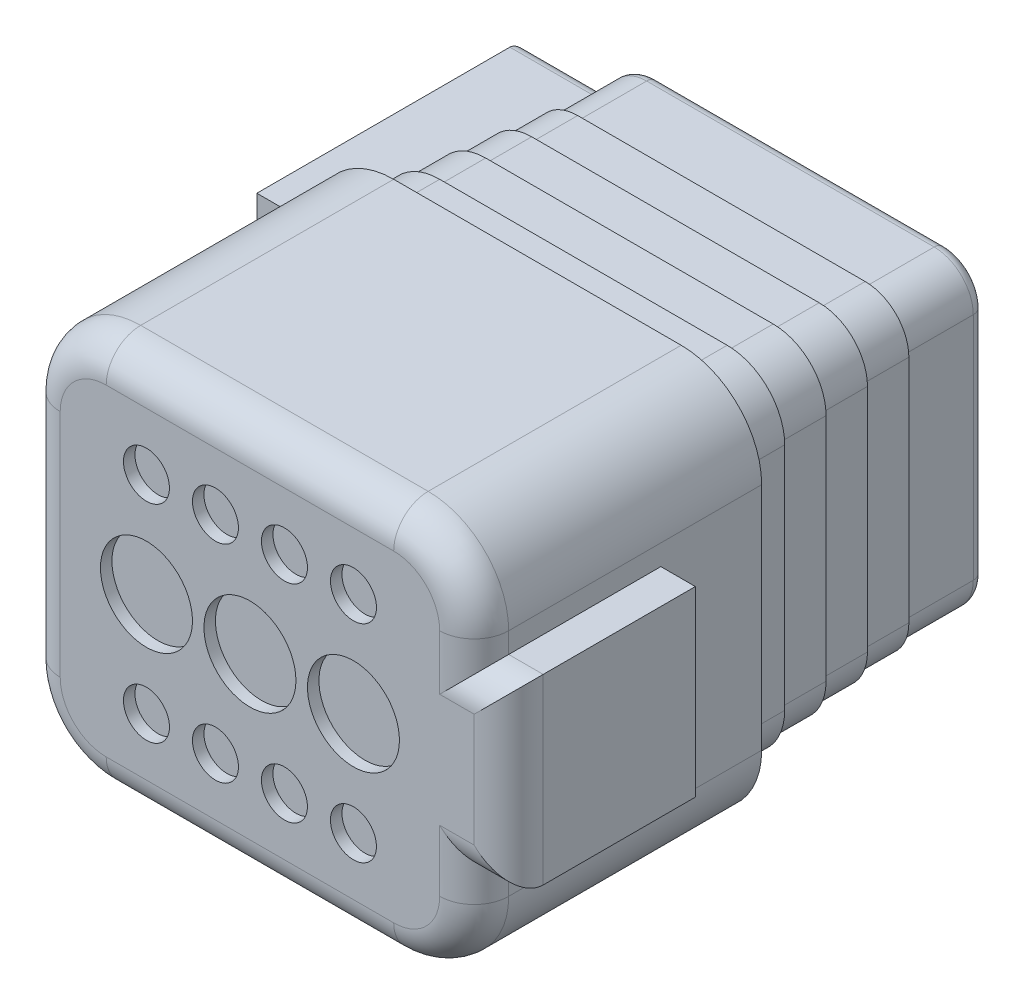
from build123d import *

# Parameters (mm, degrees)
EXTRUDE_1_DEPTH     = 25
EXTRUDE_3_DEPTH     = 4
EXTRUDE_4_DEPTH     = 4
EXTRUDE_5_DEPTH     = 4
EXTRUDE_6_DEPTH     = 4
EXTRUDE_7_DEPTH     = 7
SKETCH_7_W          = 23
SKETCH_7_H          = 20
EXTRUDE_8_DEPTH     = 8.5
SKETCH_8_W          = 16.231712275
SKETCH_8_H          = 15.860541866
EXTRUDE_9_DEPTH     = 3
FILLET_1_R          = 3
FILLET_2_R          = 1
SKETCH_9_R          = 4
SKETCH_9_R_2        = 2
CUT_EXTRUDE_1_DEPTH = 1
CUT_EXTRUDE_START   = -1
SKETCH_10_R         = 4
SKETCH_10_R_2       = 2
CUT_EXTRUDE_2_DEPTH = 1


with BuildPart() as part:
    # ｽｹｯﾁ1 → ﾎﾞｽ - 押し出し1 (new body)
    with BuildSketch(Plane.XY):
        with BuildLine():
            Line((7, 0), (32, 0))
            ThreePointArc((32, 0), (36.949747468, 2.050252532), (39, 7))
            Line((39, 7), (39, 27))
            ThreePointArc((39, 27), (36.949747468, 31.949747468), (32, 34))
            Line((32, 34), (7, 34))
            ThreePointArc((7, 34), (2.050252532, 31.949747468), (0, 27))
            Line((0, 27), (0, 7))
            ThreePointArc((0, 7), (2.050252532, 2.050252532), (7, 0))
        make_face()
    extrude(amount=EXTRUDE_1_DEPTH)

    # ｽｹｯﾁ2 → ﾎﾞｽ - 押し出し3 (add)
    with BuildSketch(Plane(origin=(0, 0, 0), x_dir=(-1, 0, 0), z_dir=(0, 0, -1))):
        with BuildLine():
            Line((-37, 27), (-37, 7))
            ThreePointArc((-37, 7), (-35.535533906, 3.464466094), (-32, 2))
            Line((-32, 2), (-7, 2))
            ThreePointArc((-7, 2), (-3.464466094, 3.464466094), (-2, 7))
            Line((-2, 7), (-2, 27))
            ThreePointArc((-2, 27), (-3.464466094, 30.535533906), (-7, 32))
            Line((-7, 32), (-32, 32))
            ThreePointArc((-32, 32), (-35.535533906, 30.535533906), (-37, 27))
        make_face()
    extrude(amount=EXTRUDE_3_DEPTH)

    # ｽｹｯﾁ3 → ﾎﾞｽ - 押し出し4 (add)
    with BuildSketch(Plane(origin=(0, 0, -4), x_dir=(-1, 0, 0), z_dir=(0, 0, -1))):
        with BuildLine():
            Line((-32, 2.4), (-7, 2.4))
            ThreePointArc((-7, 2.4), (-3.747308807, 3.747308807), (-2.4, 7))
            Line((-2.4, 7), (-2.4, 27))
            ThreePointArc((-2.4, 27), (-3.747308807, 30.252691193), (-7, 31.6))
            Line((-7, 31.6), (-32, 31.6))
            ThreePointArc((-32, 31.6), (-35.252691193, 30.252691193), (-36.6, 27))
            Line((-36.6, 27), (-36.6, 7))
            ThreePointArc((-36.6, 7), (-35.252691193, 3.747308807), (-32, 2.4))
        make_face()
    extrude(amount=EXTRUDE_4_DEPTH)

    # ｽｹｯﾁ4 → ﾎﾞｽ - 押し出し5 (add)
    with BuildSketch(Plane(origin=(0, 0, -8), x_dir=(-1, 0, 0), z_dir=(0, 0, -1))):
        with BuildLine():
            Line((-36.2, 27), (-36.2, 7))
            ThreePointArc((-36.2, 7), (-34.969848481, 4.030151519), (-32, 2.8))
            Line((-32, 2.8), (-7, 2.8))
            ThreePointArc((-7, 2.8), (-4.030151519, 4.030151519), (-2.8, 7))
            Line((-2.8, 7), (-2.8, 27))
            ThreePointArc((-2.8, 27), (-4.030151519, 29.969848481), (-7, 31.2))
            Line((-7, 31.2), (-32, 31.2))
            ThreePointArc((-32, 31.2), (-34.969848481, 29.969848481), (-36.2, 27))
        make_face()
    extrude(amount=EXTRUDE_5_DEPTH)

    # ｽｹｯﾁ5 → ﾎﾞｽ - 押し出し6 (add)
    with BuildSketch(Plane(origin=(0, 0, -12), x_dir=(-1, 0, 0), z_dir=(0, 0, -1))):
        with BuildLine():
            Line((-35.8, 27), (-35.8, 7))
            ThreePointArc((-35.8, 7), (-34.687005769, 4.312994231), (-32, 3.2))
            Line((-32, 3.2), (-7, 3.2))
            ThreePointArc((-7, 3.2), (-4.312994231, 4.312994231), (-3.2, 7))
            Line((-3.2, 7), (-3.2, 27))
            ThreePointArc((-3.2, 27), (-4.312994231, 29.687005769), (-7, 30.8))
            Line((-7, 30.8), (-32, 30.8))
            ThreePointArc((-32, 30.8), (-34.687005769, 29.687005769), (-35.8, 27))
        make_face()
    extrude(amount=EXTRUDE_6_DEPTH)

    # ｽｹｯﾁ6 → ﾎﾞｽ - 押し出し7 (add)
    with BuildSketch(Plane(origin=(0, 0, -16), x_dir=(-1, 0, 0), z_dir=(0, 0, -1))):
        with BuildLine():
            Line((-35.4, 27), (-35.4, 7))
            ThreePointArc((-35.4, 7), (-34.404163056, 4.595836944), (-32, 3.6))
            Line((-32, 3.6), (-7, 3.6))
            ThreePointArc((-7, 3.6), (-4.595836944, 4.595836944), (-3.6, 7))
            Line((-3.6, 7), (-3.6, 27))
            ThreePointArc((-3.6, 27), (-4.595836944, 29.404163056), (-7, 30.4))
            Line((-7, 30.4), (-32, 30.4))
            ThreePointArc((-32, 30.4), (-34.404163056, 29.404163056), (-35.4, 27))
        make_face()
    extrude(amount=EXTRUDE_7_DEPTH)

    # ｽｹｯﾁ7 → ﾎﾞｽ - 押し出し8 (add)
    with BuildSketch(Plane.ZY.offset(-3.6)):
        with Locations((-11.5, 17)):
            Rectangle(SKETCH_7_W, SKETCH_7_H)
    extrude(amount=EXTRUDE_8_DEPTH)

    # ｽｹｯﾁ8 → ﾎﾞｽ - 押し出し9 (add)
    with BuildSketch(Plane(origin=(39, 0, 0), x_dir=(0, 0, -1), z_dir=(1, 0, 0))):
        with Locations((-16.884143863, 17.283223962)):
            Rectangle(SKETCH_8_W, SKETCH_8_H)
    extrude(amount=EXTRUDE_9_DEPTH)

    # ﾌｨﾚｯﾄ1
    fillet_1_edges = [part.edges().sort_by_distance(p)[0] for p in [
        (39, 26.106747447, 25),
        (40.5, 25.213494895, 25),
        (42, 17.283223962, 25),
        (40.5, 9.352953029, 25),
        (39, 8.176476514, 25),
        (36.949747468, 2.050252532, 25),
        (19.5, 0, 25),
        (2.050252532, 2.050252532, 25),
        (0, 17, 25),
        (2.050252532, 31.949747468, 25),
        (19.5, 34, 25),
        (36.949747468, 31.949747468, 25),
    ]]
    fillet(fillet_1_edges, radius=FILLET_1_R)

    # ﾌｨﾚｯﾄ2
    fillet_2_edges = [part.edges().sort_by_distance(p)[0] for p in [
        (34.404163056, 29.404163056, -23),
        (35.4, 17, -23),
        (34.404163056, 4.595836944, -23),
        (19.5, 3.6, -23),
        (4.595836944, 4.595836944, -23),
        (4.595836944, 29.404163056, -23),
        (19.5, 30.4, -23),
        (-0.65, 7, -23),
        (-0.65, 27, -23),
        (-4.9, 17, -23),
    ]]
    fillet(fillet_2_edges, radius=FILLET_2_R)

    # ｽｹｯﾁ9 → ｶｯﾄ - 押し出し1 (cut)
    with BuildSketch(Plane.XY.offset(25)):
        with Locations((19.5, 17)):
            Circle(SKETCH_9_R)
        with Locations((28.5, 17)):
            Circle(SKETCH_9_R)
        with Locations(Location((10.5, 17, 0), (0, 0, 180))):
            Circle(SKETCH_9_R)
        with Locations((16.5, 8)):
            Circle(SKETCH_9_R_2)
        with Locations((10.5, 8)):
            Circle(SKETCH_9_R_2)
        with Locations(Location((22.5, 8, 0), (0, 0, 180))):
            Circle(SKETCH_9_R_2)
        with Locations(Location((28.5, 8, 0), (0, 0, 180))):
            Circle(SKETCH_9_R_2)
        with Locations((28.5, 26)):
            Circle(SKETCH_9_R_2)
        with Locations((22.5, 26)):
            Circle(SKETCH_9_R_2)
        with Locations(Location((16.5, 26, 0), (0, 0, 180))):
            Circle(SKETCH_9_R_2)
        with Locations(Location((10.5, 26, 0), (0, 0, 180))):
            Circle(SKETCH_9_R_2)
    extrude(amount=-CUT_EXTRUDE_1_DEPTH, mode=Mode.SUBTRACT)

    # ｽｹｯﾁ10 → ｶｯﾄ - 押し出し2 (cut)
    with BuildSketch(Plane(origin=(0, 0, -23), x_dir=(-1, 0, 0), z_dir=(0, 0, -1)).offset(CUT_EXTRUDE_START)):
        with Locations(Location((-19.5, 17, 0), (0, 0, 180))):
            Circle(SKETCH_10_R)
        with Locations((-10.5, 17)):
            Circle(SKETCH_10_R)
        with Locations(Location((-28.5, 17, 0), (0, 0, 180))):
            Circle(SKETCH_10_R)
        with Locations((-16.5, 26)):
            Circle(SKETCH_10_R_2)
        with Locations((-10.5, 26)):
            Circle(SKETCH_10_R_2)
        with Locations(Location((-28.5, 26, 0), (0, 0, 180))):
            Circle(SKETCH_10_R_2)
        with Locations(Location((-22.5, 26, 0), (0, 0, 180))):
            Circle(SKETCH_10_R_2)
        with Locations(Location((-10.5, 8, 0), (0, 0, 180))):
            Circle(SKETCH_10_R_2)
        with Locations(Location((-16.5, 8, 0), (0, 0, 180))):
            Circle(SKETCH_10_R_2)
        with Locations((-22.5, 8)):
            Circle(SKETCH_10_R_2)
        with Locations((-28.5, 8)):
            Circle(SKETCH_10_R_2)
    extrude(amount=CUT_EXTRUDE_2_DEPTH, mode=Mode.SUBTRACT)


solid = part.part
